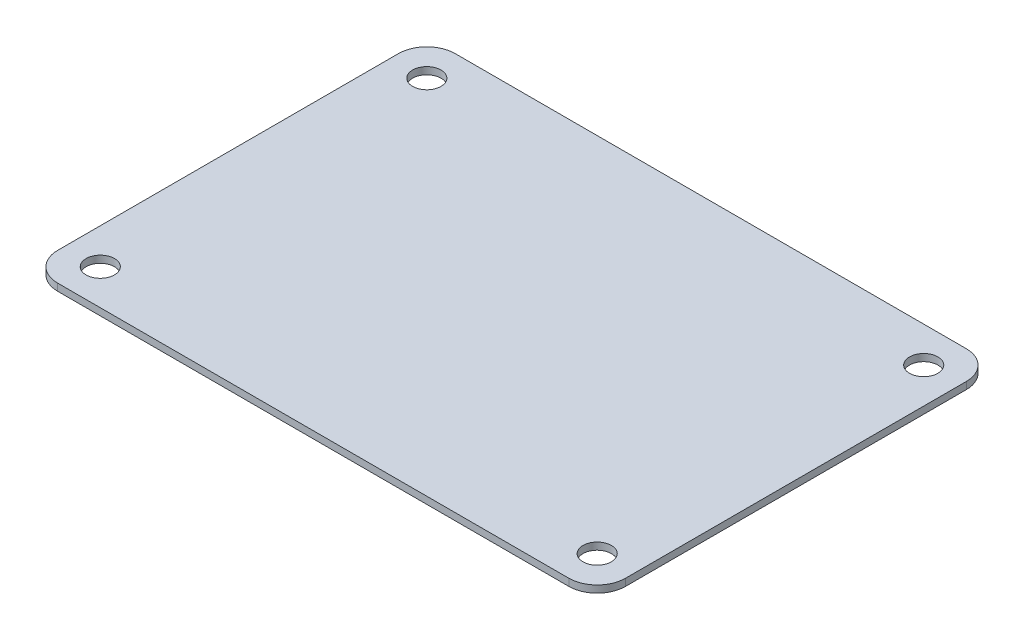
from build123d import *

# Parameters (mm, degrees)
SKETCH1_W           = 254
SKETCH1_H           = 177.8
SKETCH1_R           = 6.35
BOSS_EXTRUDE1_DEPTH = 3.175
FILLET1_R           = 12.7


with BuildPart() as part:
    # Sketch1 → Boss-Extrude1 (new body)
    with BuildSketch(Plane(origin=(0, 0, 0), x_dir=(1, 0, 0), z_dir=(0, 1, 0))):
        Rectangle(SKETCH1_W, SKETCH1_H)
        with Locations(Location((-111.125, -73.025, 0), (0, 0, 270))):
            Circle(SKETCH1_R, mode=Mode.SUBTRACT)
        with Locations(Location((-111.125, 73.025, 0), (0, 0, 270))):
            Circle(SKETCH1_R, mode=Mode.SUBTRACT)
        with Locations(Location((111.125, 73.025, 0), (0, 0, 270))):
            Circle(SKETCH1_R, mode=Mode.SUBTRACT)
        with Locations(Location((111.125, -73.025, 0), (0, 0, 270))):
            Circle(SKETCH1_R, mode=Mode.SUBTRACT)
    extrude(amount=BOSS_EXTRUDE1_DEPTH)

    # Fillet1
    fillet1_edges = [part.edges().sort_by_distance(p)[0] for p in [
        (-127, 1.5875, -88.9),
        (127, 1.5875, -88.9),
        (127, 1.5875, 88.9),
        (-127, 1.5875, 88.9),
    ]]
    fillet(fillet1_edges, radius=FILLET1_R)


solid = part.part
